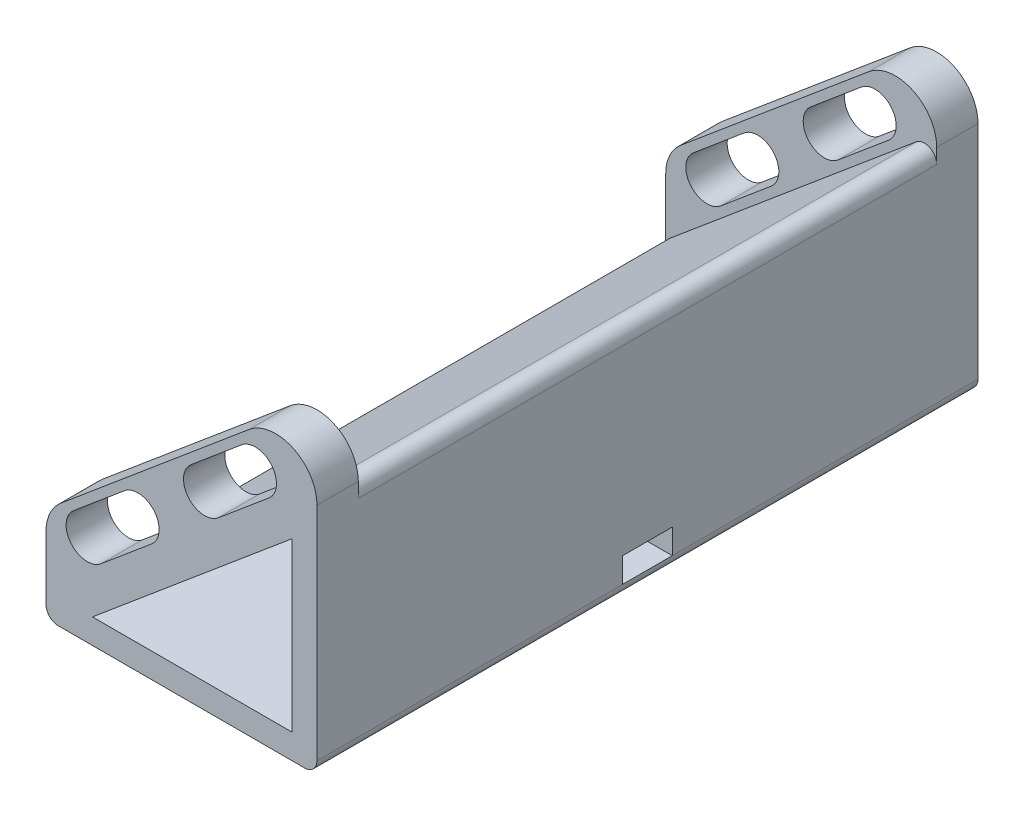
from build123d import *

# Parameters (mm, degrees)
BOSS_EXTRUDE1_DEPTH  = 40
BOSS_EXTRUDE2_DEPTH  = 5
FILLET1_R            = 5
CUT_EXTRUDE2_DEPTH   = 92.598097397
FILLET1_OF_MIRROR1_R = 5
SKETCH8_W            = 6
SKETCH8_H            = 3
CUT_EXTRUDE3_DEPTH   = 6


with BuildPart() as part:
    # Sketch1 → Boss-Extrude1 (new, symmetric)
    with BuildSketch(Plane.XY):
        with BuildLine():
            ThreePointArc((0.964181415, -1.149066665), (0.513030215, -1.409538931), (0, -1.5))
            Line((0, -1.5), (29.793839815, -1.5))
            ThreePointArc((29.793839815, -1.5), (28.733179643, -1.060660172), (28.293839815, 0))
            Line((28.293839815, 0), (28.293839815, 1.5))
            Line((28.293839815, 1.5), (4.121216129, 1.5))
            Line((4.121216129, 1.5), (0.964181415, -1.149066665))
        make_face()
        with BuildLine():
            Line((28.8296584, 26.149066665), (-0.964181415, 1.149066665))
            ThreePointArc((-0.964181415, 1.149066665), (-0.513030215, 1.409538931), (0, 1.5))
            Line((0, 1.5), (4.121216129, 1.5))
            Line((4.121216129, 1.5), (28.293839815, 21.783239619))
            Line((28.293839815, 21.783239619), (28.293839815, 25))
            ThreePointArc((28.293839815, 25), (28.434378134, 25.633927393), (28.8296584, 26.149066665))
        make_face()
        with BuildLine():
            Line((31.293839815, 0), (31.293839815, 25))
            ThreePointArc((31.293839815, 25), (31.153301495, 24.366072607), (30.758021229, 23.850933335))
            Line((30.758021229, 23.850933335), (28.293839815, 21.783239619))
            Line((28.293839815, 21.783239619), (28.293839815, 1.5))
            Line((28.293839815, 1.5), (29.793839815, 1.5))
            ThreePointArc((29.793839815, 1.5), (30.854499987, 1.060660172), (31.293839815, 0))
        make_face()
        with BuildLine():
            ThreePointArc((28.293839815, 0), (28.733179643, -1.060660172), (29.793839815, -1.5))
            ThreePointArc((29.793839815, -1.5), (30.854499987, -1.060660172), (31.293839815, 0))
            ThreePointArc((31.293839815, 0), (30.854499987, 1.060660172), (29.793839815, 1.5))
            Line((29.793839815, 1.5), (28.293839815, 1.5))
            Line((28.293839815, 1.5), (28.293839815, 0))
        make_face()
        with BuildLine():
            ThreePointArc((0, 1.5), (-0.513030215, 1.409538931), (-0.964181415, 1.149066665))
            ThreePointArc((-0.964181415, 1.149066665), (-1.409538931, -0.513030215), (0, -1.5))
            ThreePointArc((0, -1.5), (0.513030215, -1.409538931), (0.964181415, -1.149066665))
            Line((0.964181415, -1.149066665), (4.121216129, 1.5))
            Line((4.121216129, 1.5), (0, 1.5))
        make_face()
        with BuildLine():
            ThreePointArc((31.293839815, 25), (30.427767207, 26.359461681), (28.8296584, 26.149066665))
            ThreePointArc((28.8296584, 26.149066665), (28.434378134, 25.633927393), (28.293839815, 25))
            Line((28.293839815, 25), (28.293839815, 21.783239619))
            Line((28.293839815, 21.783239619), (30.758021229, 23.850933335))
            ThreePointArc((30.758021229, 23.850933335), (31.153301495, 24.366072607), (31.293839815, 25))
        make_face()
    extrude(amount=BOSS_EXTRUDE1_DEPTH, both=True)

    # Sketch5 → Boss-Extrude2 (add)
    with BuildSketch(Plane.XY.offset(40)):
        Polygon((-1.5, 0), (-1.5, 10), (31.293839815, 37.517298894), (31.293839815, 25), align=None)
    boss_extrude2 = extrude(amount=-BOSS_EXTRUDE2_DEPTH)

    # Fillet1
    fillet1_edges = [part.edges().sort_by_distance(p)[0] for p in [
        (-1.5, 10, 37.5),
        (31.293839815, 37.517298894, 37.5),
    ]]
    fillet(fillet1_edges, radius=FILLET1_R)

    # Sketch7 → Cut-Extrude2 (cut, symmetric)
    with BuildSketch(Plane.XY.offset(40)):
        with BuildLine():
            Line((1.852977001, 11.508074476), (7.981332546, 16.650375353))
            ThreePointArc((7.981332546, 16.650375353), (11.591201121, 16.334552776), (11.275378544, 12.724684201))
            Line((11.275378544, 12.724684201), (5.147022999, 7.582383323))
            ThreePointArc((5.147022999, 7.582383323), (1.537154424, 7.898205901), (1.852977001, 11.508074476))
        make_face()
        with BuildLine():
            Line((22.182635401, 28.566683341), (16.054279856, 23.424382464))
            ThreePointArc((16.054279856, 23.424382464), (15.738457279, 19.814513889), (19.348325854, 19.498691312))
            Line((19.348325854, 19.498691312), (25.476681399, 24.640992189))
            ThreePointArc((25.476681399, 24.640992189), (25.792503976, 28.250860764), (22.182635401, 28.566683341))
        make_face()
    cut_extrude2 = extrude(amount=CUT_EXTRUDE2_DEPTH, both=True, mode=Mode.SUBTRACT)

    # Mirror1: Boss-Extrude2, Cut-Extrude2 across plane
    add(boss_extrude2.mirror(Plane.XY))
    add(cut_extrude2.mirror(Plane.XY), mode=Mode.SUBTRACT)

    # Fillet1 of Mirror1
    fillet1_of_mirror1_edges = [part.edges().sort_by_distance(p)[0] for p in [
        (-1.5, 10, -37.5),
        (31.293839815, 37.517298894, -37.5),
    ]]
    fillet(fillet1_of_mirror1_edges, radius=FILLET1_OF_MIRROR1_R)

    # Sketch8 → Cut-Extrude3 (cut)
    with BuildSketch(Plane(origin=(31.293839815, 0, 0), x_dir=(0, 0, -1), z_dir=(1, 0, 0))):
        with Locations((0, 1.5)):
            Rectangle(SKETCH8_W, SKETCH8_H)
    extrude(amount=-CUT_EXTRUDE3_DEPTH, mode=Mode.SUBTRACT)


solid = part.part
